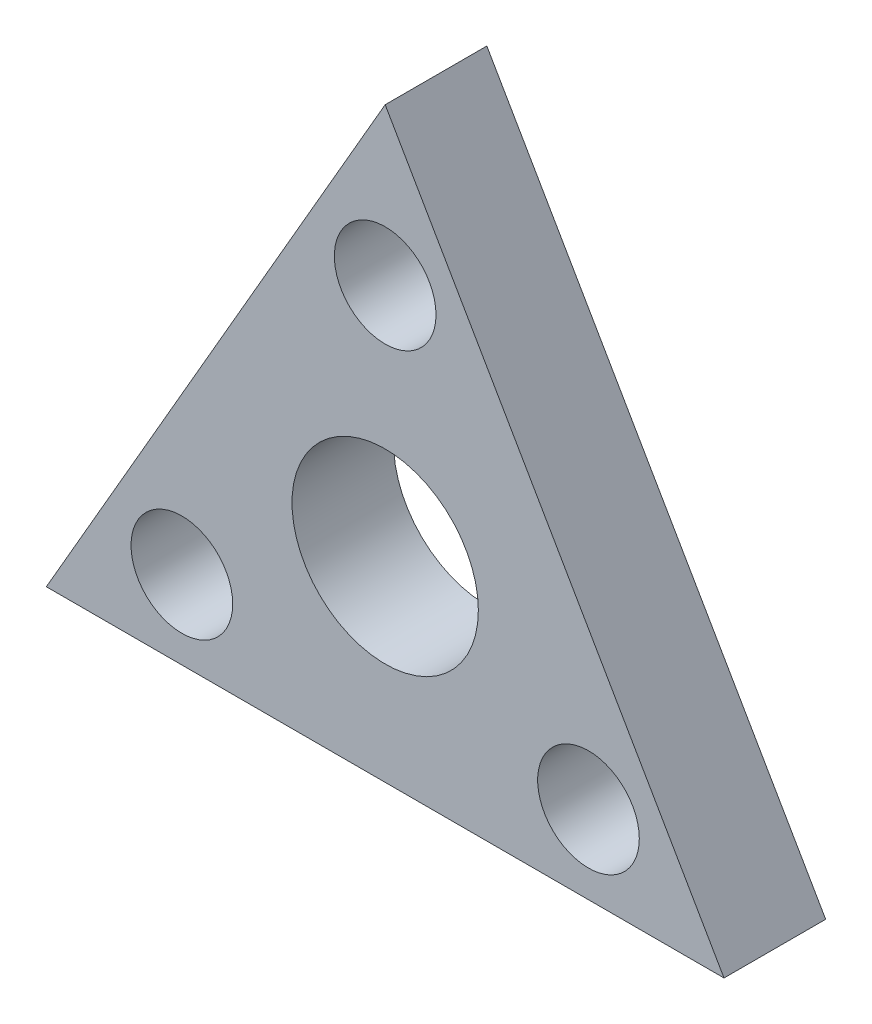
from build123d import *

# Parameters (mm, degrees)
SKETCH_1_R      = 1.5
SKETCH_1_R_2    = 2.75
EXTRUDE_1_DEPTH = 3


with BuildPart() as part:
    # 草图1 → 凸台-拉伸1 (new body)
    with BuildSketch(Plane.XY):
        Polygon((0, 11.547005384), (-10, -5.773502692), (10, -5.773502692), align=None)
        with Locations((0, 6.92820323)):
            Circle(SKETCH_1_R, mode=Mode.SUBTRACT)
        with Locations((-6, -3.464101615)):
            Circle(SKETCH_1_R, mode=Mode.SUBTRACT)
        with Locations((6, -3.464101615)):
            Circle(SKETCH_1_R, mode=Mode.SUBTRACT)
        Circle(SKETCH_1_R_2, mode=Mode.SUBTRACT)
    extrude(amount=EXTRUDE_1_DEPTH)


solid = part.part
